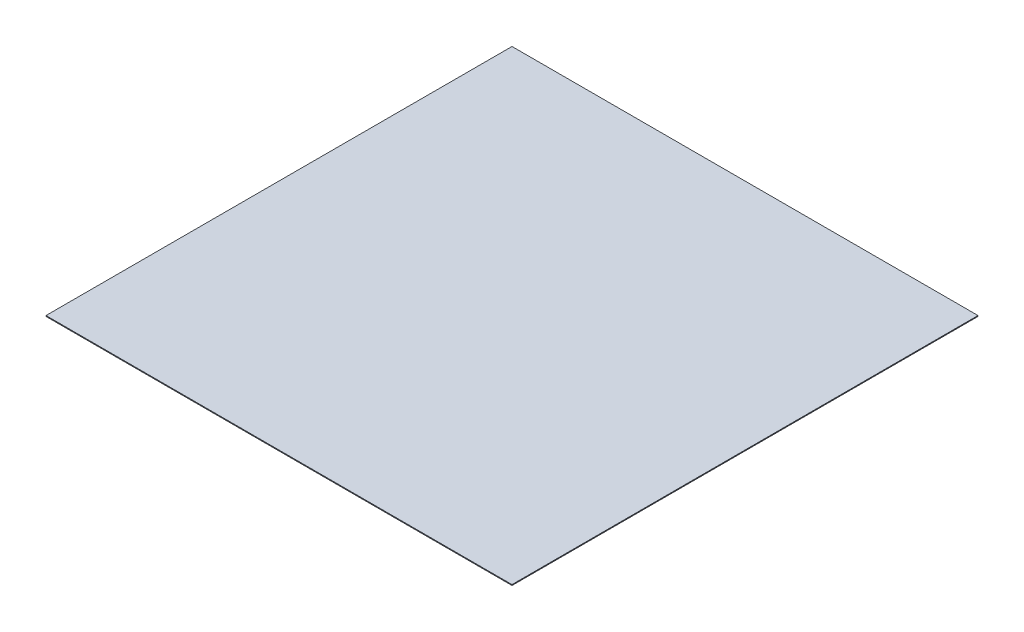
from build123d import *

# Parameters (mm, degrees)
SKETCH1_W           = 139.7
SKETCH1_H           = 139.7
BOSS_EXTRUDE1_DEPTH = 0.125


with BuildPart() as part:
    # Sketch1 → Boss-Extrude1 (new, symmetric)
    with BuildSketch(Plane(origin=(0, 0, 0), x_dir=(1, 0, 0), z_dir=(0, 1, 0))):
        Rectangle(SKETCH1_W, SKETCH1_H)
    extrude(amount=BOSS_EXTRUDE1_DEPTH, both=True)


solid = part.part
